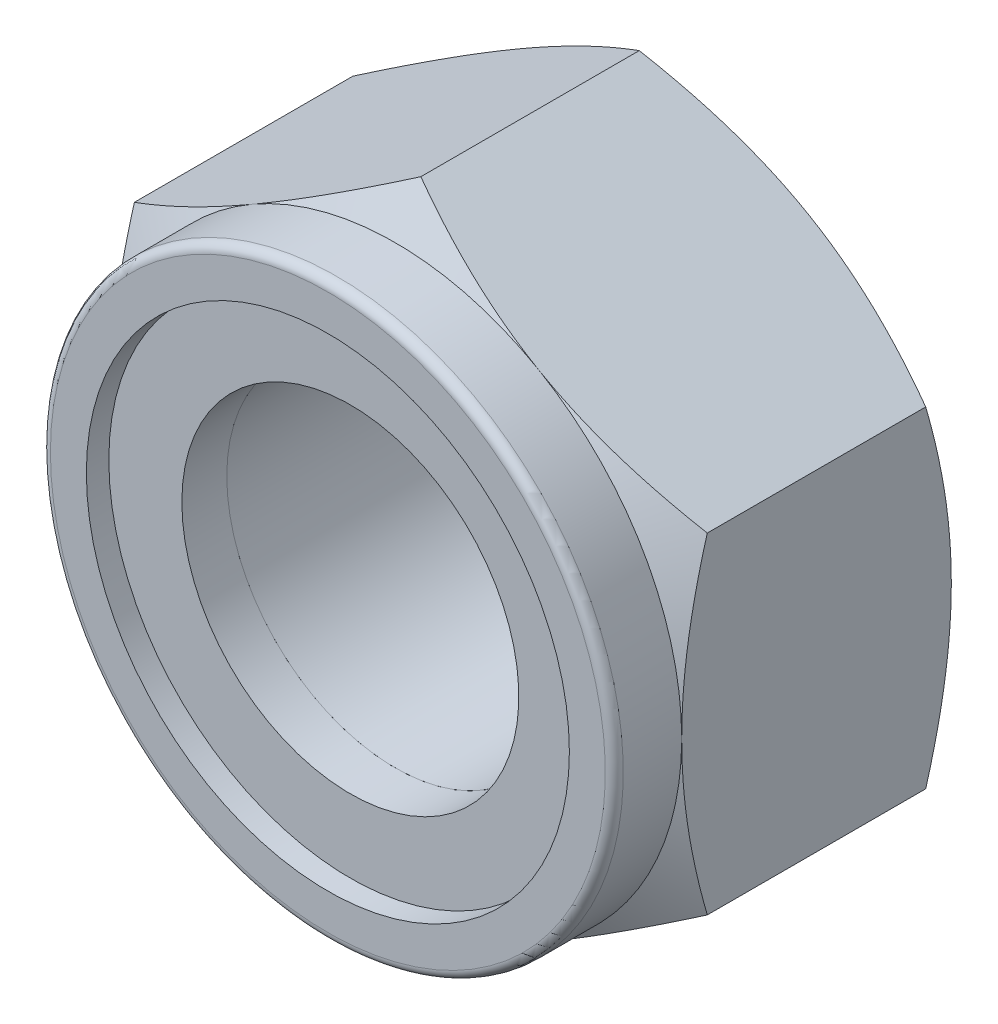
from build123d import *

# Parameters (mm, degrees)
EXTRUDE1_DEPTH     = 8
SKETCH5_R          = 7.833333333
SKETCH5_R_2        = 5
EXTRUDE2_DEPTH     = 1.333333333
SKETCH4_R          = 5
CUT_EXTRUDE1_DEPTH = 17.388512237
FILLET2_R          = 0.266666667


with BuildPart() as part:
    # Sketch1 → Extrude1 (new body)
    with BuildSketch(Plane.XY):
        Polygon((0, 9.814954576), (-8.5, 4.907477288), (-8.5, -4.907477288), (0, -9.814954576), (8.5, -4.907477288), (8.5, 4.907477288), align=None)
    extrude(amount=EXTRUDE1_DEPTH)

    # Sketch2 → Cut-Revolve1 (revolve, cut)
    with BuildSketch(Plane(origin=(0, 0, 0), x_dir=(1, 0, 0), z_dir=(0, 1, 0))):
        Polygon((8.5, -8), (11.9, -8), (11.9, -6.037009085), align=None)
    cut_revolve1 = revolve(axis=Axis((0, 0, 0), (0, 0, 1)), mode=Mode.SUBTRACT)

    # Mirror1: Cut-Revolve1 across plane
    add(cut_revolve1.mirror(Plane(origin=(0, 0, 4), x_dir=(1, 0, 0), z_dir=(0, 0, -1))), mode=Mode.SUBTRACT)

    # Sketch3 → Revolve1 (revolve)
    with BuildSketch(Plane(origin=(0, 0, 0), x_dir=(1, 0, 0), z_dir=(0, 1, 0)), mode=Mode.PRIVATE) as revolve1_sk:
        Polygon((8.5, -8), (8.5, -10), (7.166666667, -10), (7.166666667, -9.333333333), (7.833333333, -9.333333333), (7.833333333, -8), align=None)
    revolve(revolve1_sk.sketch.rotate(Axis((0, 0, 0), (0, 0, 1)), 180), axis=Axis((0, 0, 0), (0, 0, 1)))

    # Sketch4 → Cut-Extrude1 (cut, through all)
    with BuildSketch(Plane(origin=(0, 0, 0), x_dir=(-1, 0, 0), z_dir=(0, 0, -1))):
        Circle(SKETCH4_R)
    extrude(amount=-CUT_EXTRUDE1_DEPTH, mode=Mode.SUBTRACT)

    # Fillet2
    fillet2_edges = [part.edges().sort_by_distance(p)[0] for p in [
        (8.5, 0, 10),
    ]]
    fillet(fillet2_edges, radius=FILLET2_R)


with BuildPart() as body_2:
    # Sketch5 → Extrude2 (new body)
    with BuildSketch(Plane.XY.offset(8)):
        with Locations(Location((0, 0, 0), (0, 0, 180))):
            Circle(SKETCH5_R)
        with Locations(Location((0, 0, 0), (0, 0, 180))):
            Circle(SKETCH5_R_2, mode=Mode.SUBTRACT)
    extrude(amount=EXTRUDE2_DEPTH)


solid = Compound([part.part, body_2.part])
